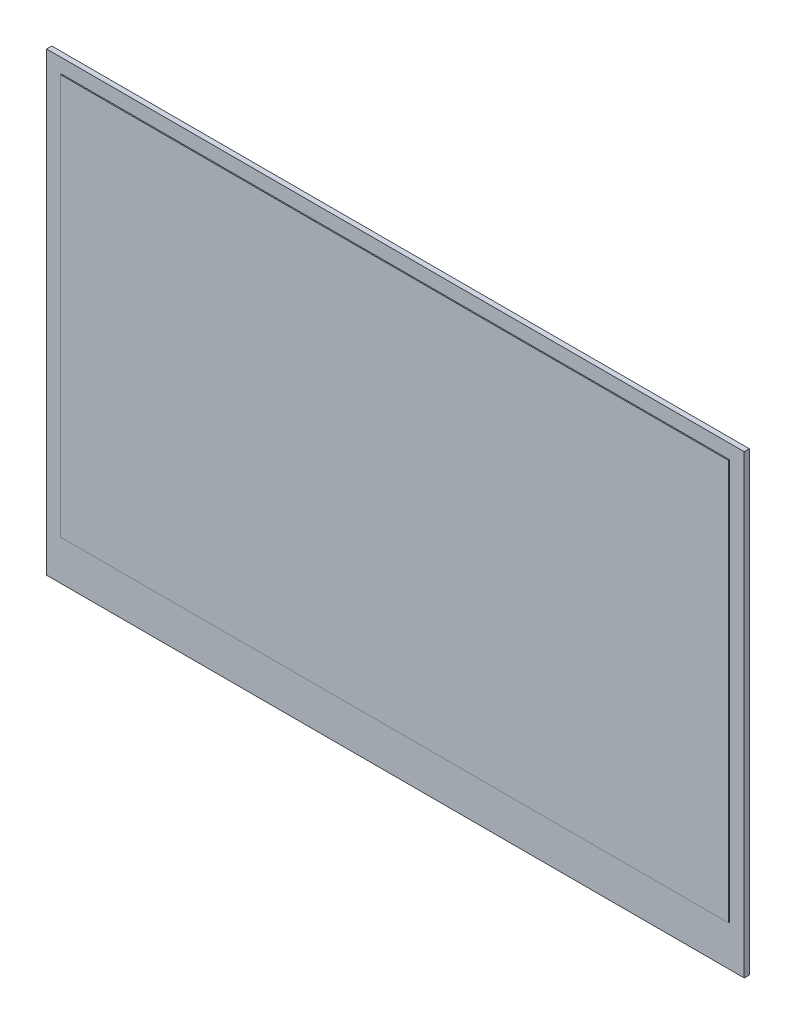
from build123d import *

# Parameters (mm, degrees)
SKETCH_1_W      = 170.2
SKETCH_1_H      = 111.2
EXTRUDE_1_DEPTH = 1.25
SKETCH_3_W      = 163
SKETCH_3_H      = 97.72
EXTRUDE_2_DEPTH = 0.25


with BuildPart() as part:
    # 草图1 → 凸台-拉伸1 (new body)
    with BuildSketch(Plane.XY):
        Rectangle(SKETCH_1_W, SKETCH_1_H)
    extrude(amount=EXTRUDE_1_DEPTH)

    # 草图3 → 凸台-拉伸2 (add)
    with BuildSketch(Plane.XY.offset(1.25)):
        with Locations((0, 3.25)):
            Rectangle(SKETCH_3_W, SKETCH_3_H)
    extrude(amount=EXTRUDE_2_DEPTH)


solid = part.part
